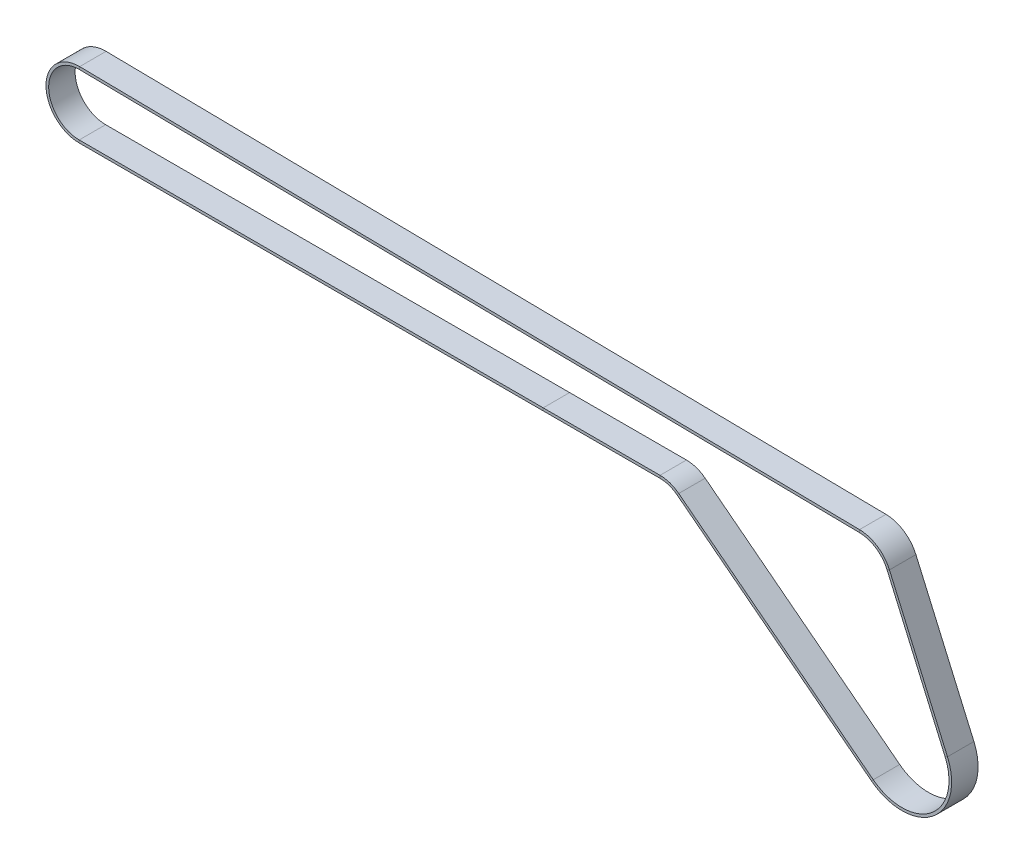
from build123d import *

# Parameters (mm, degrees)
SKETCH_4_W = 10
SKETCH_4_H = 1


with BuildPart() as part:
    # 掃出1: sweep along a path in 草圖2
    with BuildLine(Plane.XY) as sweep_1_path:
        Line((152.003384949, -38.242833415), (130.05681925, 12.006884535))
        ThreePointArc((130.05681925, 12.006884535), (125.863591091, 17.005534481), (119.631157887, 18.935933413))
        Line((119.631157887, 18.935933413), (-175.339326769, 23.108843899))
        ThreePointArc((-175.339326769, 23.108843899), (-187.057488522, 11.636727435), (-175.502777551, 0))
        Line((-175.502777551, 0), (44.192301821, 0))
        ThreePointArc((44.192301821, 0), (47.930804214, -0.621490735), (51.267152631, -2.419108636))
        Line((51.267152631, -2.419108636), (124.846283962, -59.398921136))
        ThreePointArc((124.846283962, -59.398921136), (146.640920811, -59.367491082), (152.003384949, -38.242833415))
    # 草圖4 → 掃出1 (sweep)
    with BuildSketch(Plane(origin=(0, 0, 0), x_dir=(0, 0, -1), z_dir=(1, 0, 0))):
        with Locations((0, -0.5)):
            Rectangle(SKETCH_4_W, SKETCH_4_H)
    sweep(path=sweep_1_path.line)


solid = part.part
